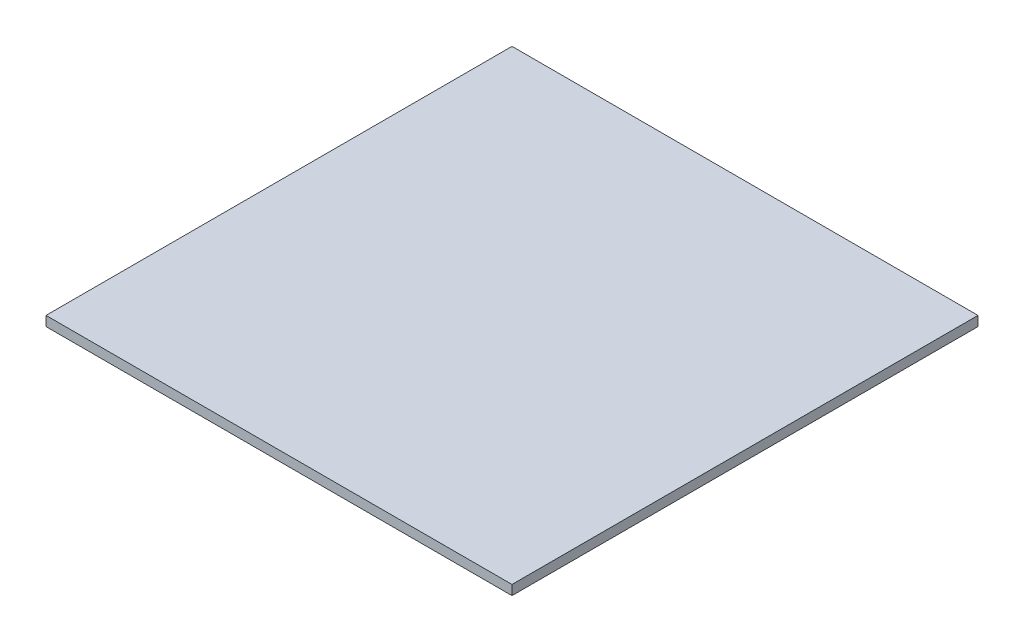
from build123d import *

# Parameters (mm, degrees)
SKETCH1_W           = 304.8
SKETCH1_H           = 304.8
BOSS_EXTRUDE1_DEPTH = 6.35


with BuildPart() as part:
    # Sketch1 → Boss-Extrude1 (new body)
    with BuildSketch(Plane(origin=(0, 0, 0), x_dir=(1, 0, 0), z_dir=(0, 1, 0))):
        with Locations((152.4, 152.4)):
            Rectangle(SKETCH1_W, SKETCH1_H)
    extrude(amount=BOSS_EXTRUDE1_DEPTH)


solid = part.part
